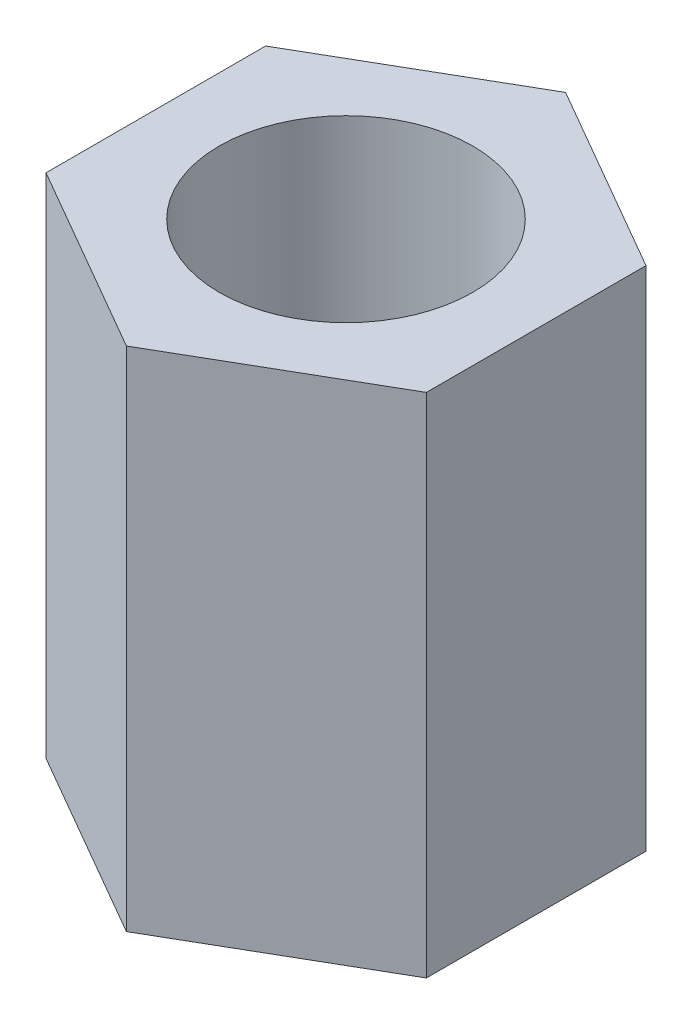
from build123d import *

# Parameters (mm, degrees)
BOSS_EXTRUDE1_DEPTH = 6
SKETCH2_R           = 1.5
CUT_EXTRUDE1_DEPTH  = 25


with BuildPart() as part:
    # Sketch1 → Boss-Extrude1 (new body)
    with BuildSketch(Plane(origin=(0, 0, 0), x_dir=(1, 0, 0), z_dir=(0, 1, 0))):
        Polygon((0, 2.598076211), (-2.25, 1.299038106), (-2.25, -1.299038106), (0, -2.598076211), (2.25, -1.299038106), (2.25, 1.299038106), align=None)
    extrude(amount=BOSS_EXTRUDE1_DEPTH)

    # Sketch2 → Cut-Extrude1 (cut)
    with BuildSketch(Plane(origin=(0, 6, 0), x_dir=(1, 0, 0), z_dir=(0, 1, 0))):
        with Locations(Location((0, 0, 0), (0, 0, 270))):
            Circle(SKETCH2_R)
    extrude(amount=-CUT_EXTRUDE1_DEPTH, mode=Mode.SUBTRACT)


solid = part.part
